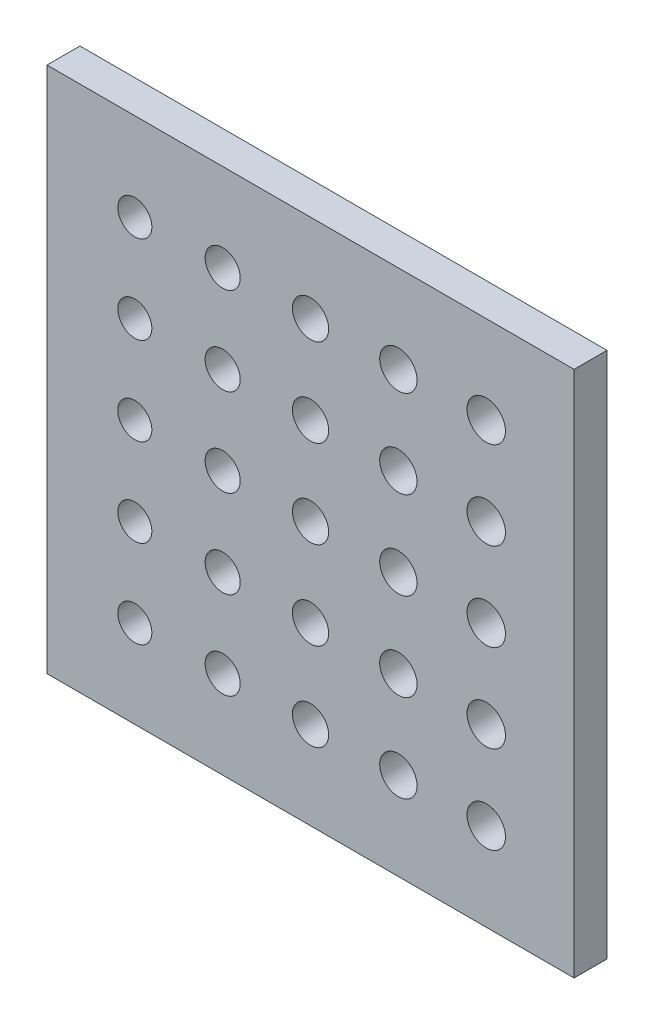
from build123d import *

# Parameters (mm, degrees)
SKETCH_1_W      = 48
SKETCH_1_H      = 48
SKETCH_1_R      = 1.55
SKETCH_1_R_2    = 1.6
SKETCH_1_R_3    = 1.65
SKETCH_1_R_4    = 1.7
SKETCH_1_R_5    = 1.75
EXTRUDE_1_DEPTH = 3


with BuildPart() as part:
    # 草图1 → 凸台-拉伸1 (new body)
    with BuildSketch(Plane.XY):
        with Locations((24, 24)):
            Rectangle(SKETCH_1_W, SKETCH_1_H)
        with Locations((8, 8)):
            Circle(SKETCH_1_R, mode=Mode.SUBTRACT)
        with Locations((8, 16)):
            Circle(SKETCH_1_R, mode=Mode.SUBTRACT)
        with Locations((8, 24)):
            Circle(SKETCH_1_R, mode=Mode.SUBTRACT)
        with Locations((8, 32)):
            Circle(SKETCH_1_R, mode=Mode.SUBTRACT)
        with Locations((8, 40)):
            Circle(SKETCH_1_R, mode=Mode.SUBTRACT)
        with Locations((16, 8)):
            Circle(SKETCH_1_R_2, mode=Mode.SUBTRACT)
        with Locations((16, 16)):
            Circle(SKETCH_1_R_2, mode=Mode.SUBTRACT)
        with Locations((16, 24)):
            Circle(SKETCH_1_R_2, mode=Mode.SUBTRACT)
        with Locations((16, 32)):
            Circle(SKETCH_1_R_2, mode=Mode.SUBTRACT)
        with Locations((16, 40)):
            Circle(SKETCH_1_R_2, mode=Mode.SUBTRACT)
        with Locations((24, 8)):
            Circle(SKETCH_1_R_3, mode=Mode.SUBTRACT)
        with Locations((24, 16)):
            Circle(SKETCH_1_R_3, mode=Mode.SUBTRACT)
        with Locations((24, 24)):
            Circle(SKETCH_1_R_3, mode=Mode.SUBTRACT)
        with Locations((24, 32)):
            Circle(SKETCH_1_R_3, mode=Mode.SUBTRACT)
        with Locations((24, 40)):
            Circle(SKETCH_1_R_3, mode=Mode.SUBTRACT)
        with Locations((32, 8)):
            Circle(SKETCH_1_R_4, mode=Mode.SUBTRACT)
        with Locations((32, 16)):
            Circle(SKETCH_1_R_4, mode=Mode.SUBTRACT)
        with Locations((32, 24)):
            Circle(SKETCH_1_R_4, mode=Mode.SUBTRACT)
        with Locations((32, 32)):
            Circle(SKETCH_1_R_4, mode=Mode.SUBTRACT)
        with Locations((32, 40)):
            Circle(SKETCH_1_R_4, mode=Mode.SUBTRACT)
        with Locations((40, 8)):
            Circle(SKETCH_1_R_5, mode=Mode.SUBTRACT)
        with Locations((40, 16)):
            Circle(SKETCH_1_R_5, mode=Mode.SUBTRACT)
        with Locations((40, 24)):
            Circle(SKETCH_1_R_5, mode=Mode.SUBTRACT)
        with Locations((40, 32)):
            Circle(SKETCH_1_R_5, mode=Mode.SUBTRACT)
        with Locations((40, 40)):
            Circle(SKETCH_1_R_5, mode=Mode.SUBTRACT)
    extrude(amount=EXTRUDE_1_DEPTH)


solid = part.part
